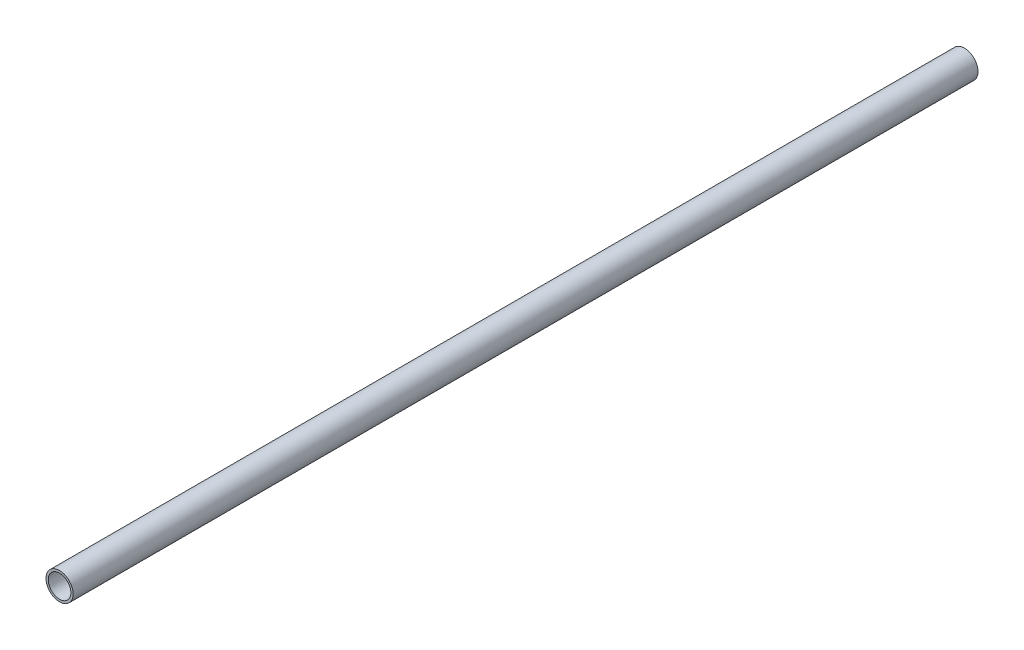
from build123d import *

# Parameters (mm, degrees)
SKETCH1_R           = 6
SKETCH1_R_2         = 5
BOSS_EXTRUDE1_DEPTH = 400


with BuildPart() as part:
    # Sketch1 → Boss-Extrude1 (new body)
    with BuildSketch(Plane.XY):
        Circle(SKETCH1_R)
        Circle(SKETCH1_R_2, mode=Mode.SUBTRACT)
    extrude(amount=BOSS_EXTRUDE1_DEPTH)


solid = part.part
